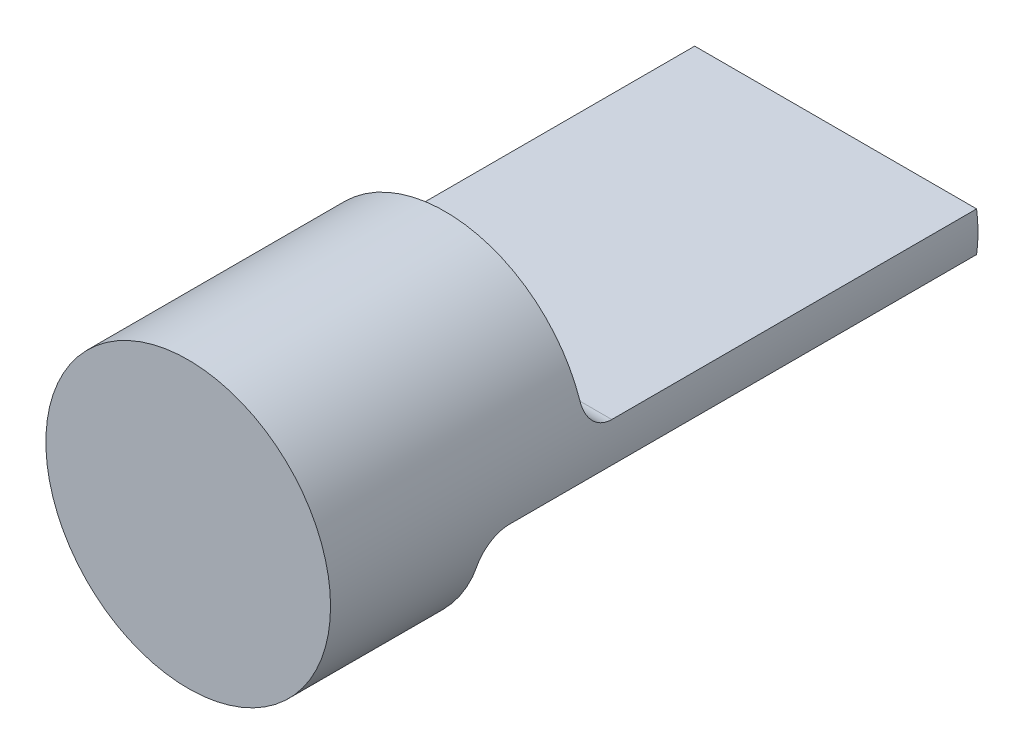
from build123d import *

# Parameters (mm, degrees)
SKETCH1_R               = 13.85
BOSS_EXTRUDE1_DEPTH     = 63
CUT_EXTRUDE1_DEPTH      = 66.974578437
CUT_EXTRUDE1_DEPTH_BACK = 66.974578437


with BuildPart() as part:
    # Sketch1 → Boss-Extrude1 (new body)
    with BuildSketch(Plane.XY):
        Circle(SKETCH1_R)
    extrude(amount=BOSS_EXTRUDE1_DEPTH)

    # Sketch3 → Cut-Extrude1 (cut, two sides: drawn at the far end of the back side and taken through both)
    with BuildSketch(Plane(origin=(0, 0, 0), x_dir=(0, 0, -1), z_dir=(1, 0, 0)).offset(-CUT_EXTRUDE1_DEPTH_BACK)):
        with BuildLine():
            Line((0, 1.925), (-35.5, 1.925))
            ThreePointArc((-35.5, 1.925), (-37.267766953, 2.657233047), (-38, 4.425))
            Line((-38, 4.425), (-38, 13.85))
            Line((-38, 13.85), (0, 13.85))
            Line((0, 13.85), (0, 1.925))
        make_face()
        with BuildLine():
            Line((0, -1.925), (-45.5, -1.925))
            ThreePointArc((-45.5, -1.925), (-47.267766953, -2.657233047), (-48, -4.425))
            Line((-48, -4.425), (-48, -13.85))
            Line((-48, -13.85), (0, -13.85))
            Line((0, -13.85), (0, -1.925))
        make_face()
    extrude(amount=CUT_EXTRUDE1_DEPTH + CUT_EXTRUDE1_DEPTH_BACK, mode=Mode.SUBTRACT)


solid = part.part
